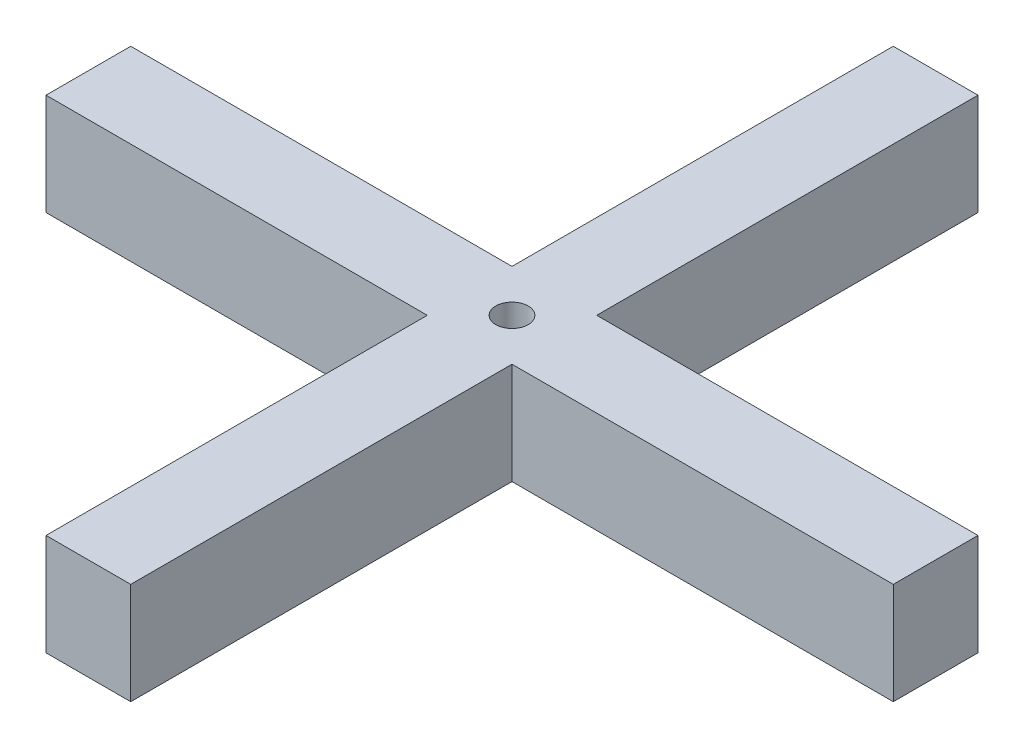
from build123d import *

# Parameters (mm, degrees)
SKETCH1_W           = 6.35
SKETCH1_H           = 28.575
SKETCH1_H_2         = 6.35
SKETCH1_W_2         = 28.575
BOSS_EXTRUDE1_DEPTH = 7.62
SKETCH2_R           = 1.213900036
CUT_EXTRUDE1_DEPTH  = 46.543269536


with BuildPart() as part:
    # Sketch1 → Boss-Extrude1 (new body)
    with BuildSketch(Plane(origin=(0, 0, 0), x_dir=(1, 0, 0), z_dir=(0, 1, 0))):
        with Locations((0, 17.4625)):
            Rectangle(SKETCH1_W, SKETCH1_H)
        Rectangle(SKETCH1_W, SKETCH1_H_2)
        with Locations((0, -17.4625)):
            Rectangle(SKETCH1_W, SKETCH1_H)
        with Locations((17.4625, 0)):
            Rectangle(SKETCH1_W_2, SKETCH1_H_2)
        with Locations((-17.4625, 0)):
            Rectangle(SKETCH1_W_2, SKETCH1_H_2)
    extrude(amount=BOSS_EXTRUDE1_DEPTH)

    # Sketch2 → Cut-Extrude1 (cut, through all)
    with BuildSketch(Plane(origin=(0, 7.62, 0), x_dir=(1, 0, 0), z_dir=(0, 1, 0))):
        with Locations(Location((0, 0, 0), (0, 0, 270))):
            Circle(SKETCH2_R)
    extrude(amount=-CUT_EXTRUDE1_DEPTH, mode=Mode.SUBTRACT)


solid = part.part
